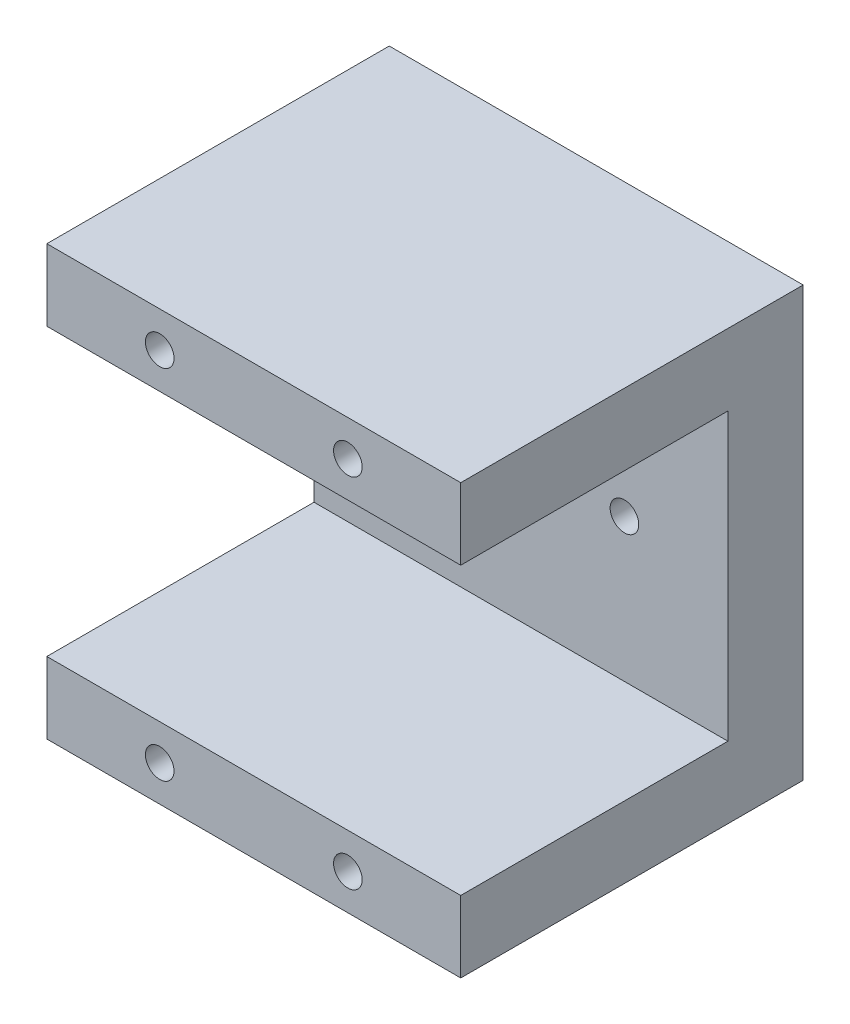
from build123d import *

# Parameters (mm, degrees)
SKETCH1_W           = 55
SKETCH1_H           = 57
BOSS_EXTRUDE1_DEPTH = 45.5
SKETCH2_W           = 55
SKETCH2_H           = 38
CUT_EXTRUDE1_DEPTH  = 35.5
SKETCH3_R           = 1.9
CUT_EXTRUDE2_DEPTH  = 10
SKETCH4_R           = 1.9
CUT_EXTRUDE3_DEPTH  = 20


with BuildPart() as part:
    # Sketch1 → Boss-Extrude1 (new body)
    with BuildSketch(Plane.XY):
        Rectangle(SKETCH1_W, SKETCH1_H)
    extrude(amount=BOSS_EXTRUDE1_DEPTH)

    # Sketch2 → Cut-Extrude1 (cut)
    with BuildSketch(Plane.XY.offset(45.5)):
        Rectangle(SKETCH2_W, SKETCH2_H)
    extrude(amount=-CUT_EXTRUDE1_DEPTH, mode=Mode.SUBTRACT)

    # Sketch3 → Cut-Extrude2 (cut)
    with BuildSketch(Plane(origin=(0, 0, 0), x_dir=(-1, 0, 0), z_dir=(0, 0, -1))):
        with Locations((-13.75, 0)):
            Circle(SKETCH3_R)
        with Locations((13.75, 0)):
            Circle(SKETCH3_R)
    extrude(amount=-CUT_EXTRUDE2_DEPTH, mode=Mode.SUBTRACT)

    # Sketch4 → Cut-Extrude3 (cut)
    with BuildSketch(Plane.XY.offset(45.5)):
        with Locations((-12.5, 23.75)):
            Circle(SKETCH4_R)
        with Locations((12.5, 23.75)):
            Circle(SKETCH4_R)
        with Locations((-12.5, -23.75)):
            Circle(SKETCH4_R)
        with Locations((12.5, -23.75)):
            Circle(SKETCH4_R)
    extrude(amount=-CUT_EXTRUDE3_DEPTH, mode=Mode.SUBTRACT)


solid = part.part
